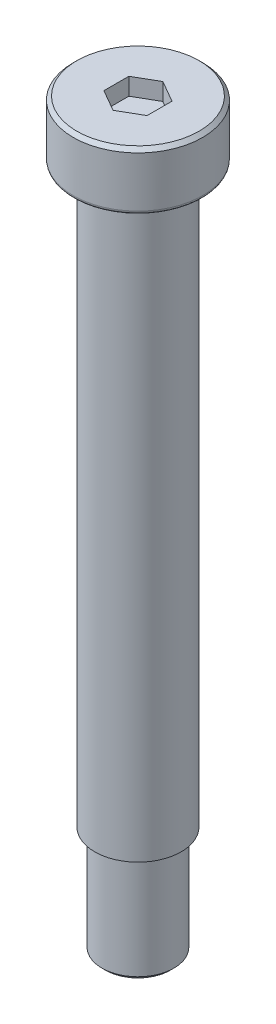
from build123d import *

# Parameters (mm, degrees)
CUT_EXTRUDE1_DEPTH = 2.4
CHAMFER1_SIZE      = 0.5
FILLET1_R          = 0.5
CHAMFER2_SIZE      = 0.5


with BuildPart() as part:
    # Sketch1 → Revolve1 (revolve)
    with BuildSketch(Plane.XY, mode=Mode.PRIVATE) as revolve1_sk:
        Polygon((0, 0), (9, 0), (9, -8), (5.75, -8), (5.75, -8.5), (6, -8.5), (6, -88), (5, -88), (5, -103), (0, -103), align=None)
    revolve(revolve1_sk.sketch.rotate(Axis((0, 5, 0), (0, -1, 0)), 180), axis=Axis((0, 5, 0), (0, -1, 0)))

    # Sketch2 → Cut-Extrude1 (cut)
    with BuildSketch(Plane(origin=(0, 0, 0), x_dir=(1, 0, 0), z_dir=(0, 1, 0))):
        Polygon((0, -3.464101615), (3, -1.732050808), (3, 1.732050808), (0, 3.464101615), (-3, 1.732050808), (-3, -1.732050808), align=None)
    extrude(amount=-CUT_EXTRUDE1_DEPTH, mode=Mode.SUBTRACT)

    # Chamfer1
    chamfer1_edges = [part.edges().sort_by_distance(p)[0] for p in [
        (9, 0, 0),
    ]]
    chamfer(chamfer1_edges, length=CHAMFER1_SIZE)

    # Fillet1
    fillet1_edges = [part.edges().sort_by_distance(p)[0] for p in [
        (9, -8, 0),
    ]]
    fillet(fillet1_edges, radius=FILLET1_R)

    # Chamfer2
    chamfer2_edges = [part.edges().sort_by_distance(p)[0] for p in [
        (5, -103, 0),
    ]]
    chamfer(chamfer2_edges, length=CHAMFER2_SIZE)


solid = part.part
